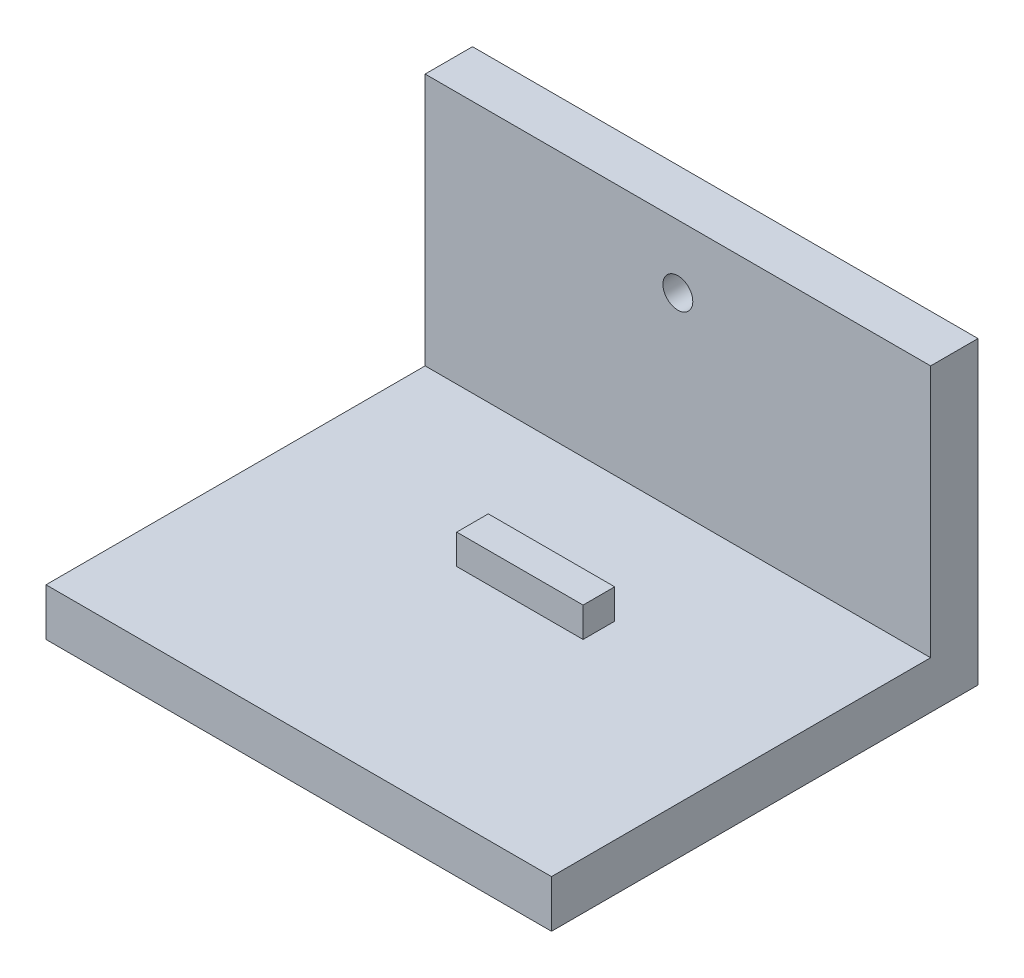
from build123d import *

# Parameters (mm, degrees)
BOSS_EXTRUDE1_DEPTH = 50.8
SKETCH2_W           = 12.7
SKETCH2_H           = 3.175
BOSS_EXTRUDE2_DEPTH = 2.9972
SKETCH3_R           = 1.499997
CUT_EXTRUDE1_DEPTH  = 71.299547696


with BuildPart() as part:
    # Sketch1 → Boss-Extrude1 (new body)
    with BuildSketch(Plane(origin=(0, 0, 0), x_dir=(0, 0, -1), z_dir=(1, 0, 0))):
        Polygon((0, 0), (-42.8625, 0), (-42.8625, 4.7625), (-4.7625, 4.7625), (-4.7625, 30.1625), (0, 30.1625), align=None)
    extrude(amount=BOSS_EXTRUDE1_DEPTH)

    # Sketch2 → Boss-Extrude2 (add)
    with BuildSketch(Plane(origin=(0, 4.7625, 0), x_dir=(1, 0, 0), z_dir=(0, 1, 0))):
        with Locations((25.4, -19.05)):
            Rectangle(SKETCH2_W, SKETCH2_H)
    extrude(amount=BOSS_EXTRUDE2_DEPTH)

    # Sketch3 → Cut-Extrude1 (cut, through all)
    with BuildSketch(Plane.XY.offset(4.7625)):
        with Locations((25.4, 23.8125)):
            Circle(SKETCH3_R)
    extrude(amount=-CUT_EXTRUDE1_DEPTH, mode=Mode.SUBTRACT)


solid = part.part
